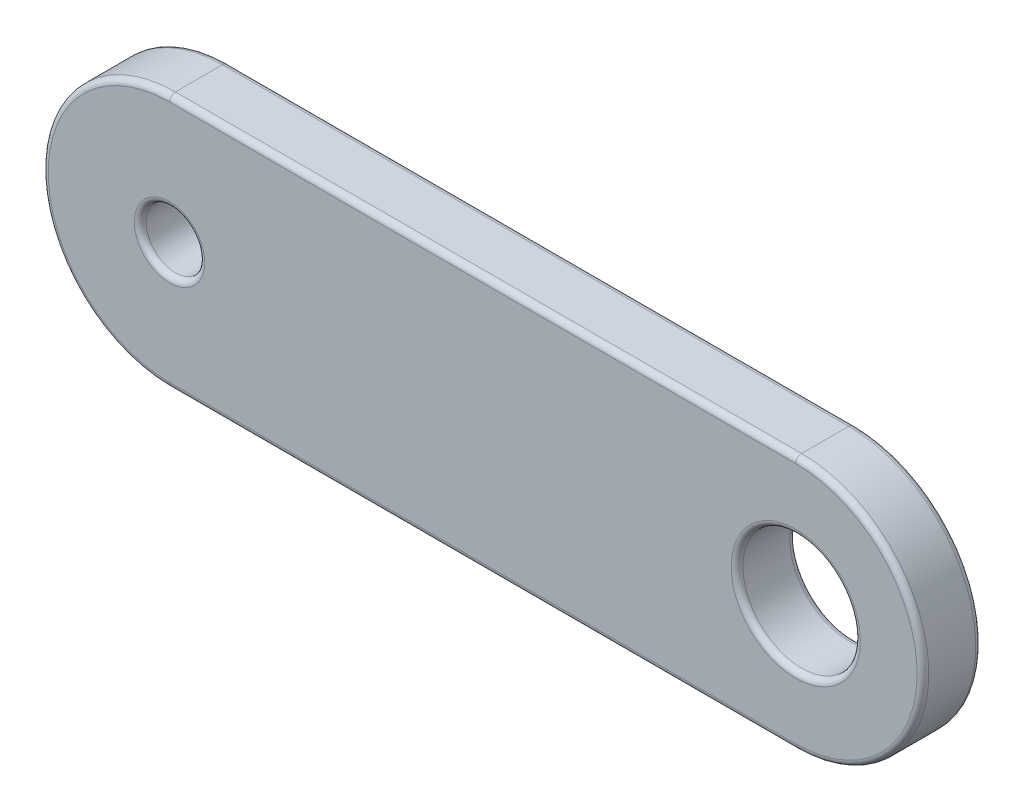
from build123d import *

# Parameters (mm, degrees)
SKETCH1_R           = 0.75
SKETCH1_R_2         = 1.5
BOSS_EXTRUDE1_DEPTH = 0.75
FILLET1_R           = 0.15


with BuildPart() as part:
    # Sketch1 → Boss-Extrude1 (new, symmetric)
    with BuildSketch(Plane.XY):
        with BuildLine():
            Line((-8, 3.25), (8, 3.25))
            ThreePointArc((8, 3.25), (11.25, 0), (8, -3.25))
            Line((8, -3.25), (-8, -3.25))
            ThreePointArc((-8, -3.25), (-11.25, 0), (-8, 3.25))
        make_face()
        with Locations((-8, 0)):
            Circle(SKETCH1_R, mode=Mode.SUBTRACT)
        with Locations((8, 0)):
            Circle(SKETCH1_R_2, mode=Mode.SUBTRACT)
    extrude(amount=BOSS_EXTRUDE1_DEPTH, both=True)

    # Fillet1
    fillet1_edges = [part.edges().sort_by_distance(p)[0] for p in [
        (11.25, 0, 0.75),
        (-8.75, 0, -0.75),
        (-8.75, 0, 0.75),
        (0, 3.25, 0.75),
        (6.5, 0, -0.75),
        (6.5, 0, 0.75),
        (-11.25, 0, 0.75),
        (0, 3.25, -0.75),
        (11.25, 0, -0.75),
        (0, -3.25, -0.75),
        (-11.25, 0, -0.75),
        (0, -3.25, 0.75),
    ]]
    fillet(fillet1_edges, radius=FILLET1_R)


solid = part.part
